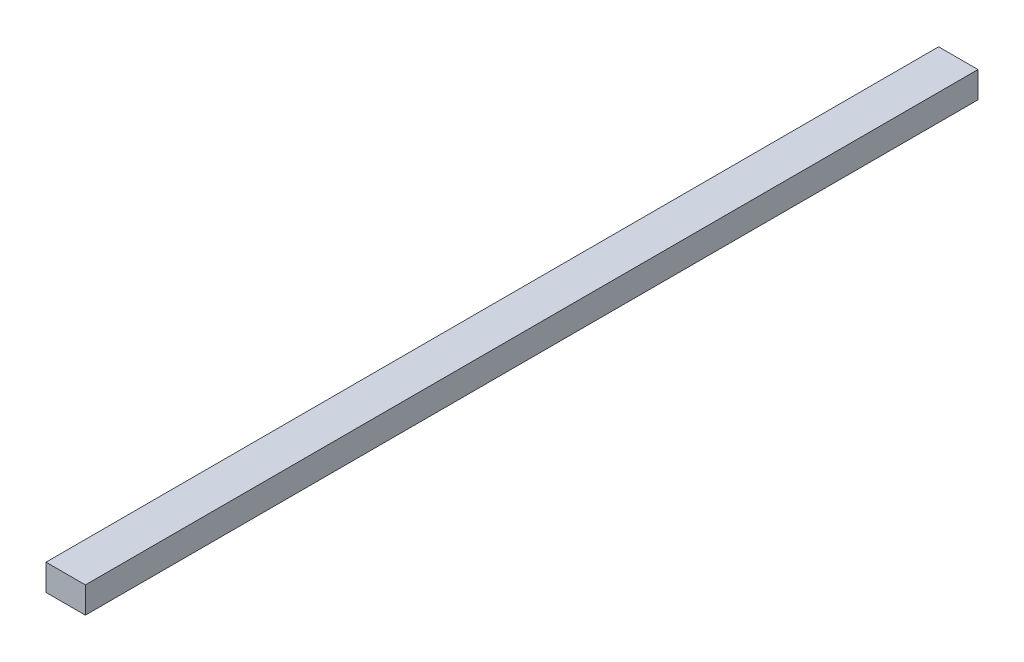
from build123d import *

# Parameters (mm, degrees)
KAPYAG_KIZAK_SOL_30X20_1_START = -20
SKETCH1_W                      = 30
SKETCH1_H                      = 20
KAPYAG_KIZAK_SOL_30X20_1_DEPTH = 680


with BuildPart() as part:
    # Sketch1 → KAPYAG_kizak_sol_30x20_1 (new body)
    with BuildSketch(Plane.XY.offset(KAPYAG_KIZAK_SOL_30X20_1_START)):
        with Locations((-50, 10)):
            Rectangle(SKETCH1_W, SKETCH1_H)
    extrude(amount=-KAPYAG_KIZAK_SOL_30X20_1_DEPTH)


solid = part.part
